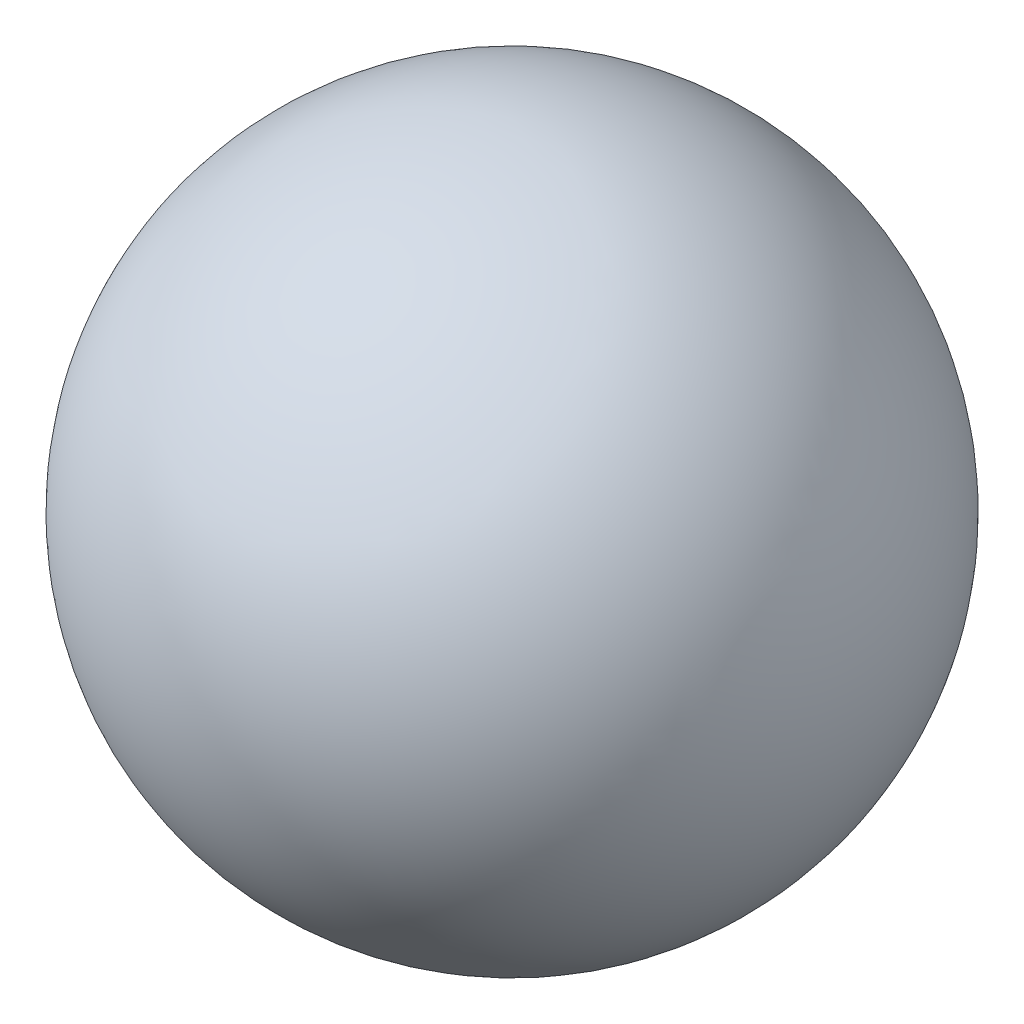
from build123d import *


with BuildPart() as part:
    # 草图1 → 旋转6 (revolve)
    with BuildSketch(Plane.XY):
        with BuildLine():
            Line((11, 0), (-11, 0))
            ThreePointArc((-11, 0), (0, 11), (11, 0))
        make_face()
    revolve(axis=Axis((11, 0, 0), (-1, 0, 0)))


solid = part.part
